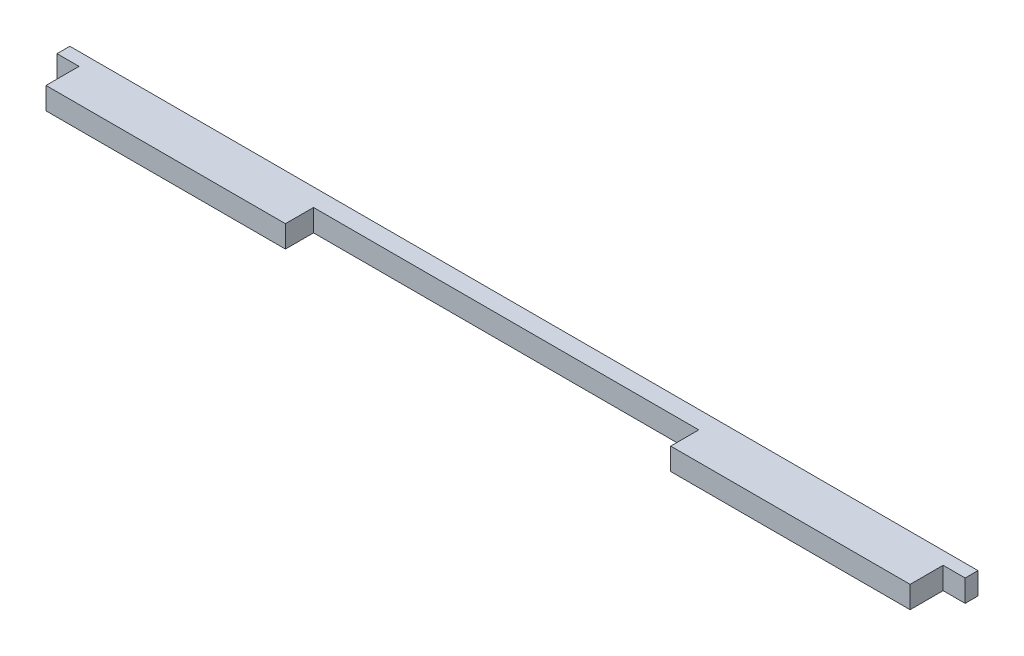
from build123d import *

# Parameters (mm, degrees)
BOSS_EXTRUDE1_DEPTH = 12
SKETCH3_W           = 12
SKETCH3_H           = 18
CUT_EXTRUDE1_DEPTH  = 12


with BuildPart() as part:
    # Sketch2 → Boss-Extrude1 (new body)
    with BuildSketch(Plane(origin=(0, 0, 0), x_dir=(1, 0, 0), z_dir=(0, 1, 0))):
        Polygon((0, 25), (0, 0), (142.5, 0), (142.5, 15.309556752), (352.5, 15.309556752), (352.5, 0), (495, 0), (495, 25), align=None)
    extrude(amount=BOSS_EXTRUDE1_DEPTH)

    # Sketch3 → Cut-Extrude1 (cut)
    with BuildSketch(Plane(origin=(0, 12, 0), x_dir=(1, 0, 0), z_dir=(0, 1, 0))):
        with Locations((6, 9)):
            Rectangle(SKETCH3_W, SKETCH3_H)
        with Locations((489, 9)):
            Rectangle(SKETCH3_W, SKETCH3_H)
    extrude(amount=-CUT_EXTRUDE1_DEPTH, mode=Mode.SUBTRACT)


solid = part.part
